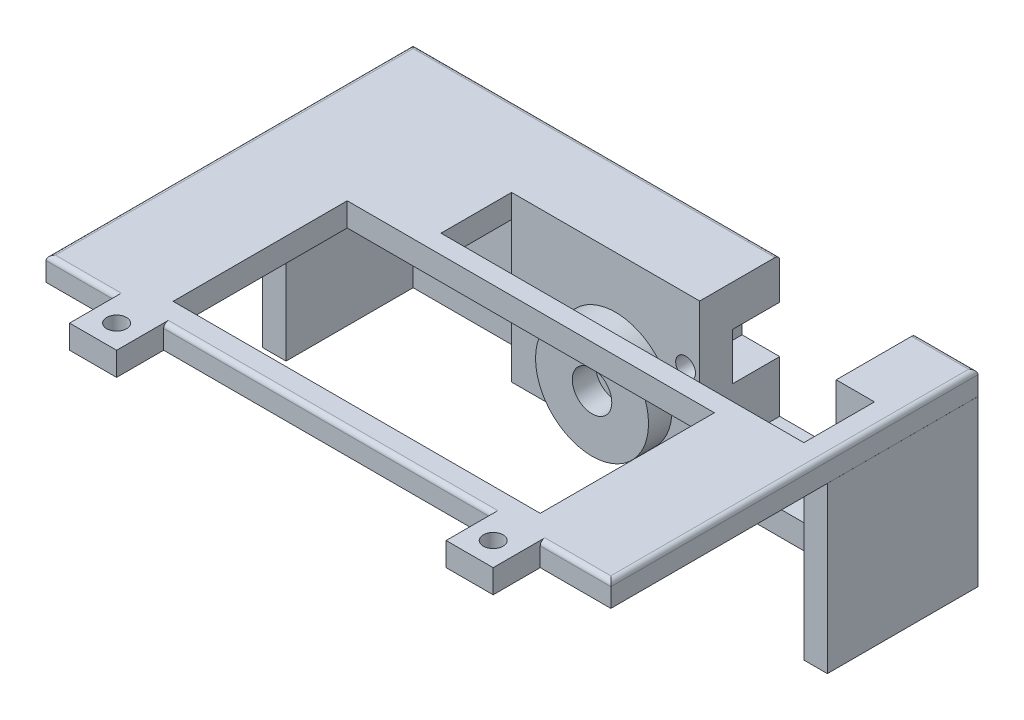
from build123d import *
from build123d.topology import SkipClean

# Parameters (mm, degrees)
SKETCH_1_R           = 12
SKETCH_1_R_2         = 4.2
EXTRUDE_1_DEPTH      = 5
SKETCH_2_R           = 2
EXTRUDE_2_DEPTH      = 5
SKETCH_3_W           = 77.124309302
SKETCH_3_H           = 14.9
EXTRUDE_3_DEPTH      = 7
EXTRUDE_6_DEPTH      = 30
SKETCH_5_W           = 29
SKETCH_5_H           = 24.72460325
CUT_EXTRUDE_16_DEPTH = 30
SKETCH_9_R           = 2.1
SKETCH_9_R_2         = 2
CUT_EXTRUDE_17_DEPTH = 17
SKETCH_6_W           = 10
SKETCH_6_H           = 10
SKETCH_6_R           = 2.1
EXTRUDE_12_DEPTH     = 5
SKETCH_7_W           = 8.124309302
SKETCH_7_H           = 7
EXTRUDE_26_DEPTH     = 30
SKETCH_7_W_2         = 40
EXTRUDE_26_2_DEPTH   = 30
SKETCH_8_W           = 29
SKETCH_8_H           = 7
EXTRUDE_29_DEPTH     = 5.27539675
SKETCH_16_R          = 2
SKETCH_16_R_2        = 2.1
CUT_EXTRUDE_19_DEPTH = 17
SKETCH_18_W          = 8
SKETCH_18_H          = 10
SKETCH_18_H_2        = 10.213480618
CUT_EXTRUDE_20_DEPTH = 10
SKETCH_19_R          = 2.1
EXTRUDE_34_DEPTH     = 5
FILLET_1_R           = 1
SKETCH_20_W          = 77.124309302
SKETCH_20_H          = 12
CUT_EXTRUDE_22_DEPTH = 15
EXTRUDE_START        = 5
SKETCH_21_R          = 2.1
EXTRUDE_38_DEPTH     = 5
SKETCH_22_W          = 5
SKETCH_22_H          = 35
EXTRUDE_39_DEPTH     = 5


with BuildPart() as part:
    # Эскиз1 → Бобышка-Вытянуть1 (new body)
    with BuildSketch(Plane(origin=(0, 0, 54.052702475), x_dir=(-1, 0, 0), z_dir=(0, 0, -1))):
        with Locations(Location((-68.741769048, 84.001425994, 0), (0, 0, 90))):
            Circle(SKETCH_1_R)
        with Locations(Location((-68.741769048, 84.001425994, 0), (0, 0, 90))):
            Circle(SKETCH_1_R_2, mode=Mode.SUBTRACT)
    extrude(amount=EXTRUDE_1_DEPTH)

    # Эскиз2 → Бобышка-Вытянуть2 (add)
    with BuildSketch(Plane(origin=(0, 0, 49.052702475), x_dir=(-1, 0, 0), z_dir=(0, 0, -1))):
        Polygon((-115.617459746, 77.276822744), (-86.617459746, 77.276822744), (-86.617459746, 93.276822744), (-86.617459746, 102.001425994), (-46.617459746, 102.001425994), (-46.617459746, 57.101425994), (-123.741769048, 57.101425994), (-123.741769048, 102.001425994), (-115.617459746, 102.001425994), (-115.617459746, 93.276822744), align=None)
        with Locations(Location((-118.617459746, 93.276822744, 0), (0, 0, 90))):
            Circle(SKETCH_2_R, mode=Mode.SUBTRACT)
        with Locations(Location((-83.617459746, 93.276822744, 0), (0, 0, 90))):
            Circle(SKETCH_2_R, mode=Mode.SUBTRACT)
    extrude(amount=EXTRUDE_2_DEPTH)

    # Эскиз3 → Бобышка-Вытянуть3 (add)
    with BuildSketch(Plane(origin=(0, 0, 44.052702475), x_dir=(-1, 0, 0), z_dir=(0, 0, -1))):
        with Locations((-85.179614397, 64.551425994)):
            Rectangle(SKETCH_3_W, SKETCH_3_H)
    extrude(amount=EXTRUDE_3_DEPTH)


with BuildPart() as body_2:
    # Эскиз4 → Бобышка-Вытянуть6 (new body)
    with BuildSketch(Plane(origin=(0, 72.001425994, 0), x_dir=(1, 0, 0), z_dir=(0, 1, 0))):
        Polygon((123.741769048, -37.052702475), (13.741769048, -37.052702475), (13.741769048, -59.052702475), (8.741769048, -59.052702475), (8.741769048, -32.052702475), (128.741769048, -32.052702475), (128.741769048, -59.052702475), (123.741769048, -59.052702475), align=None)
    extrude(amount=EXTRUDE_6_DEPTH)

    # Эскиз5 → Вырез-Вытянуть16 (cut)
    with BuildSketch(Plane(origin=(0, 0, 44.052702475), x_dir=(-1, 0, 0), z_dir=(0, 0, -1))):
        with Locations((-101.117459746, 89.639124369)):
            Rectangle(SKETCH_5_W, SKETCH_5_H)
    extrude(amount=CUT_EXTRUDE_16_DEPTH, mode=Mode.SUBTRACT)


with BuildPart() as cut_extrude_17_tool:
    # Эскиз9 → Вырез-Вытянуть17 (new body)
    with BuildSketch(Plane(origin=(0, 0, 49.052702475), x_dir=(-1, 0, 0), z_dir=(0, 0, -1))):
        with Locations((-83.617459746, 93.276822744)):
            Circle(SKETCH_9_R)
        with Locations(Location((-118.617459746, 93.276822744, 0), (0, 0, 90))):
            Circle(SKETCH_9_R_2)
    extrude(amount=CUT_EXTRUDE_17_DEPTH)


with BuildPart() as part_1:
    add(part.part)

    # Вырез-Вытянуть17: cut by cut_extrude_17_tool
    add(cut_extrude_17_tool.part, mode=Mode.SUBTRACT)



with BuildPart() as body_2_1:
    add(body_2.part)

    # Вырез-Вытянуть17: cut by cut_extrude_17_tool
    add(cut_extrude_17_tool.part, mode=Mode.SUBTRACT)

    # Эскиз6 → Бобышка-Вытянуть12 (add)
    # profile 1 of 2: a face of its own
    with BuildSketch(Plane(origin=(0, 72.001425994, 0), x_dir=(1, 0, 0), z_dir=(0, 1, 0))):
        with Locations((28.741769048, -27.052702475)):
            Rectangle(SKETCH_6_W, SKETCH_6_H)
        with Locations(Location((28.741769048, -27.052702475, 0), (0, 0, 270))):
            Circle(SKETCH_6_R, mode=Mode.SUBTRACT)
    # profile 2 of 2: a face of its own
    with BuildSketch(Plane(origin=(0, 72.001425994, 0), x_dir=(1, 0, 0), z_dir=(0, 1, 0))):
        with Locations((108.741769048, -27.052702475)):
            Rectangle(SKETCH_6_W, SKETCH_6_H)
        with Locations(Location((108.741769048, -27.052702475, 0), (0, 0, 270))):
            Circle(SKETCH_6_R, mode=Mode.SUBTRACT)
    extrude(amount=EXTRUDE_12_DEPTH)


with BuildPart() as body_3:
    # Эскиз7 → Бобышка-Вытянуть26 (new body)
    with BuildSketch(Plane(origin=(0, 72.001425994, 0), x_dir=(1, 0, 0), z_dir=(0, 1, 0))):
        with Locations((119.679614397, -40.552702475)):
            Rectangle(SKETCH_7_W, SKETCH_7_H)
    extrude(amount=EXTRUDE_26_DEPTH)


with BuildPart() as body_4:
    # Эскиз7 → Extrude 26 2 (new body)
    with BuildSketch(Plane(origin=(0, 72.001425994, 0), x_dir=(1, 0, 0), z_dir=(0, 1, 0))):
        with Locations((66.617459746, -40.552702475)):
            Rectangle(SKETCH_7_W_2, SKETCH_7_H)
    extrude(amount=EXTRUDE_26_2_DEPTH)


with BuildPart() as part_2:
    add(part_1.part)

    add(body_2_1.part)  # Бобышка-Вытянуть29 merges body 2

    add(body_3.part)  # Бобышка-Вытянуть29 merges body 3

    add(body_4.part)  # Бобышка-Вытянуть29 merges body 4
    # Эскиз8 → Бобышка-Вытянуть29 (add)
    with BuildSketch(Plane(origin=(0, 72.001425994, 0), x_dir=(1, 0, 0), z_dir=(0, 1, 0))):
        with Locations((101.117459746, -40.552702475)):
            Rectangle(SKETCH_8_W, SKETCH_8_H)
    extrude(amount=EXTRUDE_29_DEPTH)

    # Эскиз16 → Вырез-Вытянуть19 (cut)
    with BuildSketch(Plane(origin=(0, 0, 49.052702475), x_dir=(-1, 0, 0), z_dir=(0, 0, -1))):
        with Locations(Location((-118.617459746, 93.276822744, 0), (0, 0, 90))):
            Circle(SKETCH_16_R)
        with Locations(Location((-83.617459746, 93.276822744, 0), (0, 0, 90))):
            Circle(SKETCH_16_R_2)
    extrude(amount=CUT_EXTRUDE_19_DEPTH, mode=Mode.SUBTRACT)

    # Эскиз18 → Вырез-Вытянуть20 (cut)
    with BuildSketch(Plane(origin=(0, 0, 32.052702475), x_dir=(-1, 0, 0), z_dir=(0, 0, -1))):
        with Locations((-82.617459746, 93.276822744)):
            Rectangle(SKETCH_18_W, SKETCH_18_H)
        with Locations((-119.617459746, 93.383563053)):
            Rectangle(SKETCH_18_W, SKETCH_18_H_2)
    extrude(amount=-CUT_EXTRUDE_20_DEPTH, mode=Mode.SUBTRACT)

    # Эскиз19 → Бобышка-Вытянуть34 (add)
    with BuildSketch(Plane(origin=(0, 102.001425994, 0), x_dir=(1, 0, 0), z_dir=(0, 1, 0))):
        Polygon((8.741769048, -32.052702475), (86.617459746, -32.052702475), (86.617459746, -49.052702475), (46.660621761, -49.052702475), (46.660621761, -64.052702475), (123.741769048, -64.052702475), (123.741769048, -49.052702475), (115.617459746, -49.052702475), (115.617459746, -32.052702475), (128.73426593, -32.052702475), (128.741769048, -110.052702475), (113.741769048, -110.052702475), (113.741769048, -120.052702475), (103.741769048, -120.052702475), (103.741769048, -110.052702475), (33.741769048, -110.052702475), (33.741769048, -120.052702475), (23.741769048, -120.052702475), (23.741769048, -110.052702475), (8.741769048, -110.052702475), align=None)
        with Locations(Location((28.741769048, -115.052702475, 0), (0, 0, 270))):
            Circle(SKETCH_19_R, mode=Mode.SUBTRACT)
        with Locations(Location((108.741769048, -115.052702475, 0), (0, 0, 270))):
            Circle(SKETCH_19_R, mode=Mode.SUBTRACT)
        Polygon((30.740691522, -68.052702475), (30.741769048, -105.052702475), (108.741769048, -105.052702475), (108.741769048, -68.052702475), align=None, mode=Mode.SUBTRACT)
    extrude(amount=EXTRUDE_34_DEPTH)

    # Скругление1
    fillet_1_edges = [part_2.edges().sort_by_distance(p)[0] for p in [
        (8.741769048, 107.001425994, 71.052702475),
        (16.241769048, 107.001425994, 110.052702475),
        (68.741769048, 107.001425994, 110.052702475),
        (121.241769048, 107.001425994, 110.052702475),
        (128.738017489, 107.001425994, 71.052702475),
        (122.175862838, 107.001425994, 32.052702475),
        (47.679614397, 107.001425994, 32.052702475),
    ]]
    fillet(fillet_1_edges, radius=FILLET_1_R)

    # Эскиз20 → Вырез-Вытянуть22 (cut)
    with BuildSketch(Plane(origin=(0, 57.101425994, 0), x_dir=(-1, 0, 0), z_dir=(0, -1, 0))):
        with Locations((-85.179614397, -43.052702475)):
            Rectangle(SKETCH_20_W, SKETCH_20_H)
    extrude(amount=-CUT_EXTRUDE_22_DEPTH, mode=Mode.SUBTRACT)

    # Эскиз21 → Бобышка-Вытянуть38 (add)
    with SkipClean():  # the faces are left unmerged after this step: merging them gives an invalid solid
        with BuildSketch(Plane(origin=(0, 72.001425994, 0), x_dir=(-1, 0, 0), z_dir=(0, -1, 0)).offset(EXTRUDE_START)):
            Polygon((-128.741769048, -59.052702475), (-123.741769048, -59.052702475), (-123.741769048, -37.052702475), (-13.741769048, -37.052702475), (-13.741769048, -59.052702475), (-8.741769048, -59.052702475), (-8.741769048, -32.052702475), (-23.741769048, -32.052702475), (-23.741769048, -22.052702475), (-33.741769048, -22.052702475), (-33.741769048, -32.052702475), (-103.741769048, -32.052702475), (-103.741769048, -22.052702475), (-113.741769048, -22.052702475), (-113.741769048, -32.052702475), (-128.741769048, -32.052702475), align=None)
            with Locations(Location((-108.741769048, -27.052702475, 0), (0, 0, 90))):
                Circle(SKETCH_21_R, mode=Mode.SUBTRACT)
            with Locations(Location((-28.741769048, -27.052702475, 0), (0, 0, 90))):
                Circle(SKETCH_21_R, mode=Mode.SUBTRACT)
        extrude(amount=-EXTRUDE_38_DEPTH)

    # Эскиз22 → Бобышка-Вытянуть39 (add)
    with SkipClean():  # the faces are left unmerged after this step: merging them gives an invalid solid
        with BuildSketch(Plane.XY.offset(59.052702475)):
            Polygon((8.742163446, 102.001425994), (13.741769048, 102.001425994), (13.741769048, 67.001425994), (8.741769048, 67.001425994), align=None)
            with Locations((126.241769048, 84.501425994)):
                Rectangle(SKETCH_22_W, SKETCH_22_H)
        extrude(amount=EXTRUDE_39_DEPTH)


solid = part_2.part
